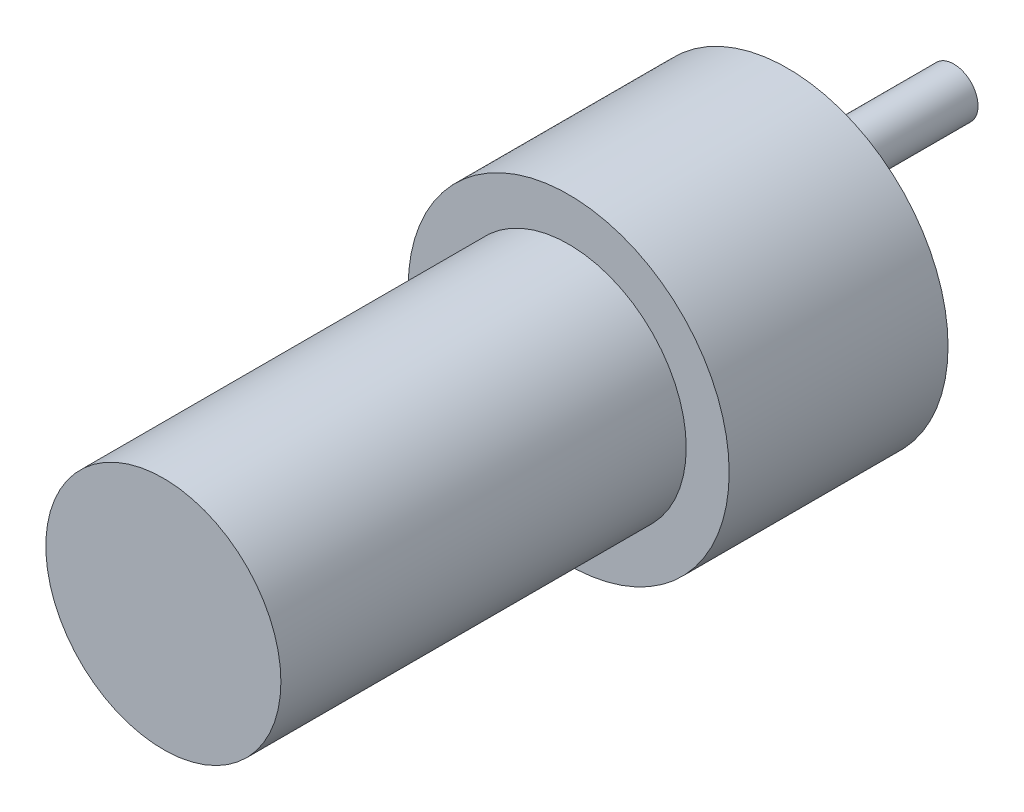
from build123d import *

# Parameters (mm, degrees)
SKETCH2_R           = 19.8
BOSS_EXTRUDE1_DEPTH = 27
SKETCH3_R           = 14.5
BOSS_EXTRUDE2_DEPTH = 50
SKETCH5_R           = 1.6
CUT_EXTRUDE1_DEPTH  = 10
SKETCH6_R           = 6
BOSS_EXTRUDE3_DEPTH = 5.5
SKETCH7_R           = 3
BOSS_EXTRUDE4_DEPTH = 15


with BuildPart() as part:
    # Sketch2 → Boss-Extrude1 (new body)
    with BuildSketch(Plane.XY):
        Circle(SKETCH2_R)
    extrude(amount=BOSS_EXTRUDE1_DEPTH)

    # Sketch3 → Boss-Extrude2 (add)
    with BuildSketch(Plane.XY.offset(27)):
        Circle(SKETCH3_R)
    extrude(amount=BOSS_EXTRUDE2_DEPTH)

    # Sketch5 → Cut-Extrude1 (cut)
    with BuildSketch(Plane(origin=(0, 0, 0), x_dir=(-1, 0, 0), z_dir=(0, 0, -1))):
        with Locations((-15.5, 0)):
            Circle(SKETCH5_R)
        with Locations((7.75, 13.423393759)):
            Circle(SKETCH5_R)
        with Locations((7.75, -13.423393759)):
            Circle(SKETCH5_R)
    extrude(amount=-CUT_EXTRUDE1_DEPTH, mode=Mode.SUBTRACT)

    # Sketch6 → Boss-Extrude3 (add)
    with BuildSketch(Plane(origin=(0, 0, 0), x_dir=(-1, 0, 0), z_dir=(0, 0, -1))):
        with Locations(Location((0, 7, 0), (0, 0, 180))):
            Circle(SKETCH6_R)
    extrude(amount=BOSS_EXTRUDE3_DEPTH)

    # Sketch7 → Boss-Extrude4 (add)
    with BuildSketch(Plane(origin=(0, 0, -5.5), x_dir=(-1, 0, 0), z_dir=(0, 0, -1))):
        with Locations((0, 7)):
            Circle(SKETCH7_R)
    extrude(amount=BOSS_EXTRUDE4_DEPTH)


solid = part.part
